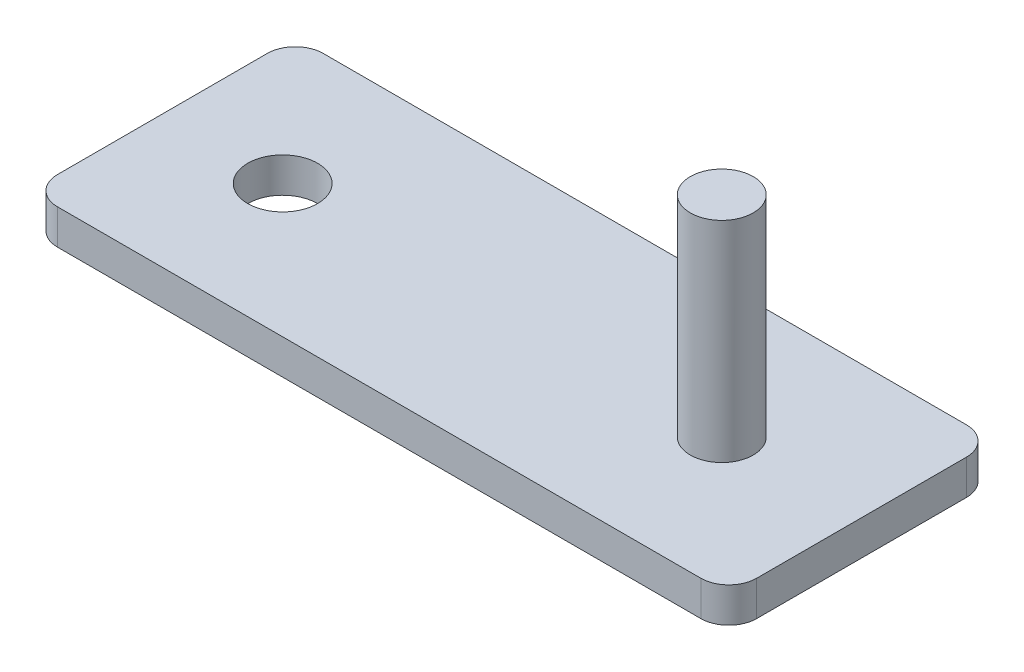
from build123d import *

# Parameters (mm, degrees)
SKETCH1_W        = 50
SKETCH1_H        = 19
SKETCH1_R        = 2.5
BASE_PLATE_DEPTH = 2.5
SKETCH2_R        = 2.25
AXIS_DEPTH       = 15
FILLET1_R        = 2


with BuildPart() as part:
    # Sketch1 → Base Plate (new body)
    with BuildSketch(Plane(origin=(0, 0, 0), x_dir=(1, 0, 0), z_dir=(0, 1, 0))):
        with Locations((25, 9.5)):
            Rectangle(SKETCH1_W, SKETCH1_H)
        with Locations(Location((8.6, 9.5, 0), (0, 0, 270))):
            Circle(SKETCH1_R, mode=Mode.SUBTRACT)
    extrude(amount=BASE_PLATE_DEPTH)

    # Sketch2 → Axis (add)
    with BuildSketch(Plane(origin=(0, 2.5, 0), x_dir=(1, 0, 0), z_dir=(0, 1, 0))):
        with Locations(Location((40, 9.5, 0), (0, 0, 90))):
            Circle(SKETCH2_R)
    extrude(amount=AXIS_DEPTH)

    # Fillet1
    fillet1_edges = [part.edges().sort_by_distance(p)[0] for p in [
        (0, 1.25, -19),
        (50, 1.25, -19),
        (50, 1.25, 0),
        (0, 1.25, 0),
    ]]
    fillet(fillet1_edges, radius=FILLET1_R)


solid = part.part
